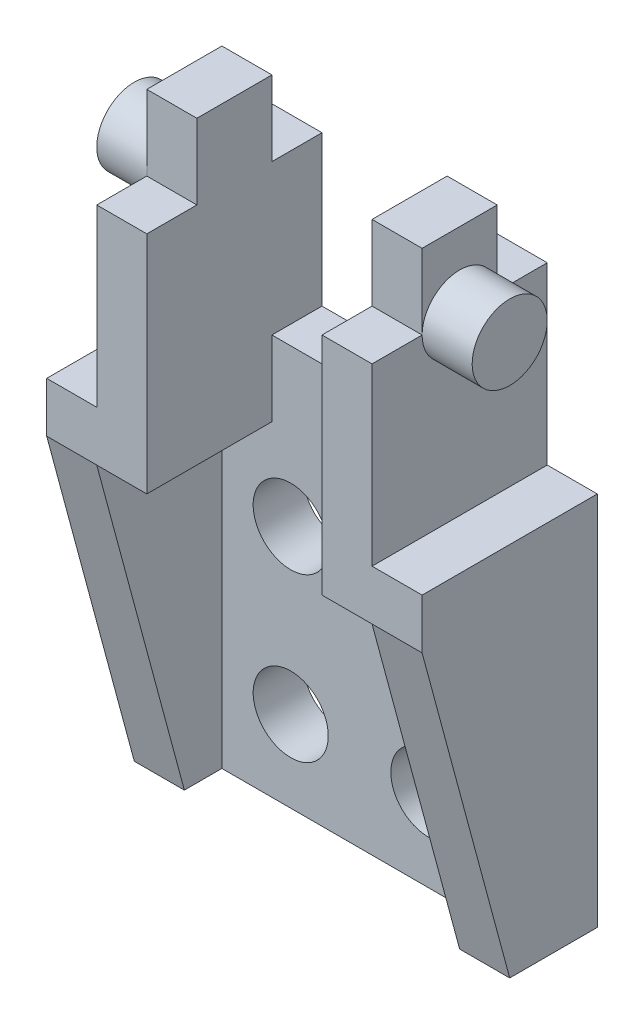
from build123d import *

# Parameters (mm, degrees)
SKETCH_1_W          = 15
SKETCH_1_H          = 25
EXTRUDE_1_DEPTH     = 7
CUT_EXTRUDE_1_DEPTH = 5
SKETCH_3_W          = 2
SKETCH_3_H          = 10
CUT_EXTRUDE_2_DEPTH = 13
SKETCH_4_W          = 2
SKETCH_4_H          = 3
CUT_EXTRUDE_3_DEPTH = 20.345542122
SKETCH_5_W          = 7
SKETCH_5_H          = 6
CUT_EXTRUDE_4_DEPTH = 13
SKETCH_6_R          = 1.5
EXTRUDE_2_DEPTH     = 2
EXTRUDE_START       = 2
SKETCH_7_R          = 1.5
EXTRUDE_3_DEPTH     = 2
CUT_EXTRUDE_5_DEPTH = 21.742468513
SKETCH_9_R          = 1.5
CUT_EXTRUDE_6_DEPTH = 16.411035007


with BuildPart() as part:
    # Эскиз1 → Бобышка-Вытянуть1 (new body)
    with BuildSketch(Plane.XY):
        Rectangle(SKETCH_1_W, SKETCH_1_H)
    extrude(amount=EXTRUDE_1_DEPTH)

    # Эскиз2 → Вырез-Вытянуть1 (cut)
    with BuildSketch(Plane.XY.offset(7)):
        Polygon((-3.5, 0.5), (-5.5, 0.5), (-5.5, -12.5), (5.5, -12.5), (5.5, 0.5), (3.5, 0.5), (3.5, 12.5), (-3.5, 12.5), align=None)
    extrude(amount=-CUT_EXTRUDE_1_DEPTH, mode=Mode.SUBTRACT)

    # Эскиз3 → Вырез-Вытянуть2 (cut)
    with BuildSketch(Plane.XY.offset(7)):
        with Locations((-6.5, 7.5)):
            Rectangle(SKETCH_3_W, SKETCH_3_H)
        with Locations((6.5, 7.5)):
            Rectangle(SKETCH_3_W, SKETCH_3_H)
    extrude(amount=-CUT_EXTRUDE_2_DEPTH, mode=Mode.SUBTRACT)

    # Эскиз4 → Вырез-Вытянуть3 (cut, through all)
    with BuildSketch(Plane.ZY.offset(5.5)):
        with Locations((6, 11)):
            Rectangle(SKETCH_4_W, SKETCH_4_H)
        with Locations((1, 11)):
            Rectangle(SKETCH_4_W, SKETCH_4_H)
    extrude(amount=-CUT_EXTRUDE_3_DEPTH, mode=Mode.SUBTRACT)

    # Эскиз5 → Вырез-Вытянуть4 (cut)
    with BuildSketch(Plane.XY.offset(2)):
        with Locations((0, 6.5)):
            Rectangle(SKETCH_5_W, SKETCH_5_H)
    extrude(amount=-CUT_EXTRUDE_4_DEPTH, mode=Mode.SUBTRACT)

    # Эскиз6 → Бобышка-Вытянуть2 (add)
    with BuildSketch(Plane.ZY.offset(5.5)):
        with Locations(Location((3.5, 9.5, 0), (0, 0, 180))):
            Circle(SKETCH_6_R)
    extrude(amount=EXTRUDE_2_DEPTH)

    # Эскиз7 → Бобышка-Вытянуть3 (add)
    with BuildSketch(Plane(origin=(5.5, 0, 0), x_dir=(0, 0, -1), z_dir=(1, 0, 0)).offset(EXTRUDE_START)):
        with Locations((-3.5, 9.5)):
            Circle(SKETCH_7_R)
    extrude(amount=-EXTRUDE_3_DEPTH)

    # Эскиз8 → Вырез-Вытянуть5 (cut, through all)
    with BuildSketch(Plane.ZY.offset(7.5)):
        Polygon((7, 0.5), (3.5, -12.5), (7, -12.5), align=None)
    extrude(amount=-CUT_EXTRUDE_5_DEPTH, mode=Mode.SUBTRACT)

    # Эскиз9 → Вырез-Вытянуть6 (cut, through all)
    with BuildSketch(Plane.XY.offset(2)):
        with Locations((-2.75, -2.75)):
            Circle(SKETCH_9_R)
        with Locations((2.75, -2.75)):
            Circle(SKETCH_9_R)
        with Locations((-2.75, -9.25)):
            Circle(SKETCH_9_R)
        with Locations((2.75, -9.25)):
            Circle(SKETCH_9_R)
    extrude(amount=-CUT_EXTRUDE_6_DEPTH, mode=Mode.SUBTRACT)


solid = part.part
